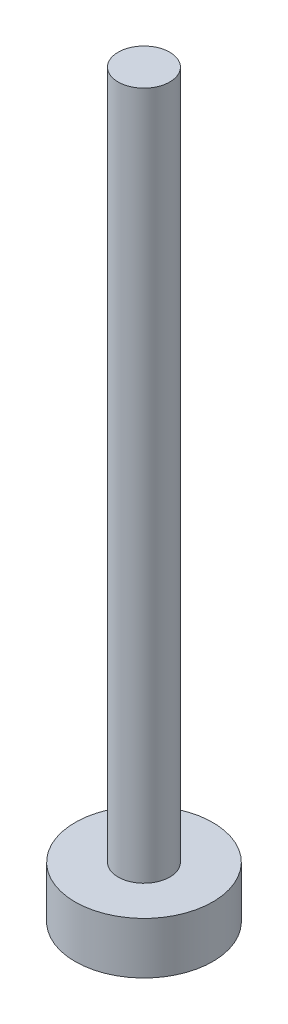
from build123d import *

# Parameters (mm, degrees)
SKETCH_1_R      = 4
EXTRUDE_1_DEPTH = 3
SKETCH_2_R      = 1.5
EXTRUDE_2_DEPTH = 40


with BuildPart() as part:
    # 草圖1 → 填料-伸長1 (new body)
    with BuildSketch(Plane(origin=(0, 0, 0), x_dir=(1, 0, 0), z_dir=(0, 1, 0))):
        with Locations(Location((0, 0, 0), (0, 0, 270))):
            Circle(SKETCH_1_R)
    extrude(amount=EXTRUDE_1_DEPTH)

    # 草圖2 → 填料-伸長2 (add)
    with BuildSketch(Plane(origin=(0, 3, 0), x_dir=(1, 0, 0), z_dir=(0, 1, 0))):
        with Locations(Location((0, 0, 0), (0, 0, 270))):
            Circle(SKETCH_2_R)
    extrude(amount=EXTRUDE_2_DEPTH)


solid = part.part
